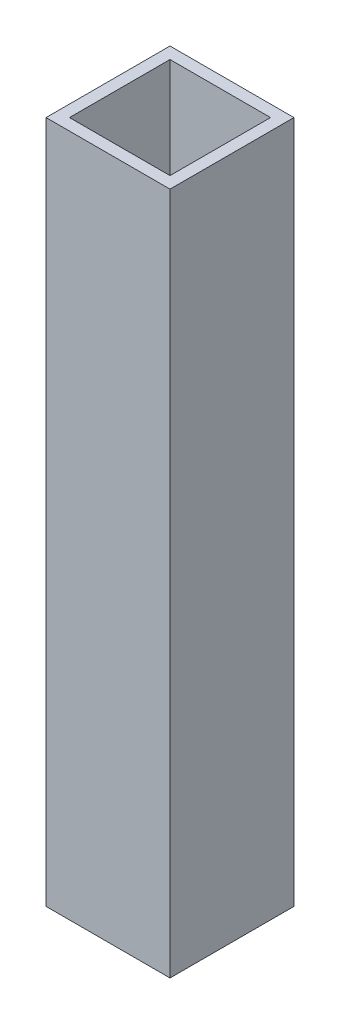
from build123d import *

# Parameters (mm, degrees)
CROQUIS1_W            = 12.7
CROQUIS1_H            = 12.7
CROQUIS1_W_2          = 10.3
CROQUIS1_H_2          = 10.3
EXTRUIR_L_MINA1_DEPTH = 70


with BuildPart() as part:
    # Croquis1 → Extruir-Lámina1 (new body)
    with BuildSketch(Plane(origin=(0, 0, 0), x_dir=(1, 0, 0), z_dir=(0, 1, 0))):
        Rectangle(CROQUIS1_W, CROQUIS1_H)
        Rectangle(CROQUIS1_W_2, CROQUIS1_H_2, mode=Mode.SUBTRACT)
    extrude(amount=EXTRUIR_L_MINA1_DEPTH)


solid = part.part
